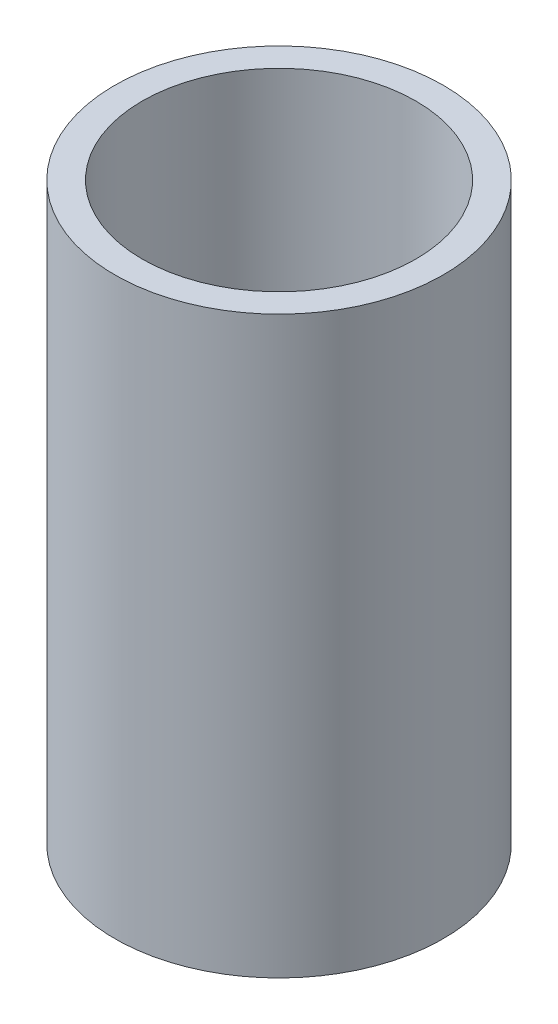
from build123d import *

# Parameters (mm, degrees)
SKETCH_1_R      = 6
SKETCH_1_R_2    = 5
EXTRUDE_1_DEPTH = 21


with BuildPart() as part:
    # 草图1 → 凸台-拉伸1 (new body)
    with BuildSketch(Plane(origin=(0, 0, 0), x_dir=(1, 0, 0), z_dir=(0, 1, 0))):
        with Locations(Location((0, 0, 0), (0, 0, 90))):
            Circle(SKETCH_1_R)
        with Locations(Location((0, 0, 0), (0, 0, 90))):
            Circle(SKETCH_1_R_2, mode=Mode.SUBTRACT)
    extrude(amount=EXTRUDE_1_DEPTH)


solid = part.part
